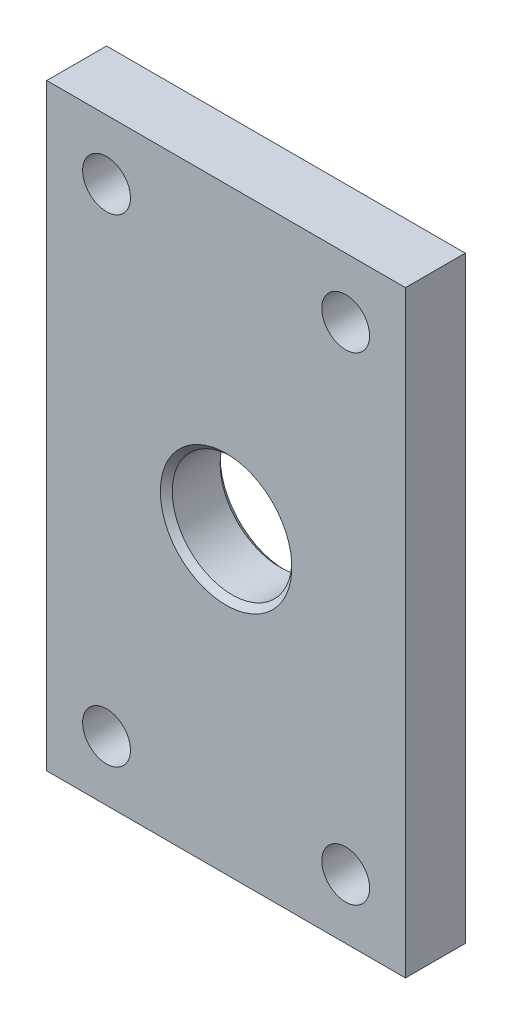
from build123d import *

# Parameters (mm, degrees)
SKETCH1_W           = 100
SKETCH1_H           = 60
BOSS_EXTRUDE1_DEPTH = 5
CUT_EXTRUDE2_START  = 5
SKETCH2_R           = 4
CUT_EXTRUDE2_DEPTH  = 64.523499554
CUT_EXTRUDE4_START  = 5
SKETCH3_R           = 4
CUT_EXTRUDE4_DEPTH  = 64.523499554
CUT_EXTRUDE6_START  = 5
SKETCH4_R           = 10
CUT_EXTRUDE6_DEPTH  = 64.523499554
CHAMFER1_SIZE       = 1


with BuildPart() as part:
    # Sketch1 → Boss-Extrude1 (new, symmetric)
    with BuildSketch(Plane(origin=(0, 0, 0), x_dir=(0, 1, 0), z_dir=(0, 0, 1))):
        Rectangle(SKETCH1_W, SKETCH1_H)
    extrude(amount=BOSS_EXTRUDE1_DEPTH, both=True)

    # Sketch2 → Cut-Extrude2 (cut, through all)
    with BuildSketch(Plane(origin=(0, 0, 0), x_dir=(0, 1, 0), z_dir=(0, 0, 1)).offset(CUT_EXTRUDE2_START)):
        with Locations(Location((-40, -20, 0), (0, 0, 270))):
            Circle(SKETCH2_R)
    extrude(amount=-CUT_EXTRUDE2_DEPTH, mode=Mode.SUBTRACT)

    # Sketch3 → Cut-Extrude4 (cut, through all)
    with BuildSketch(Plane(origin=(0, 0, 0), x_dir=(0, 1, 0), z_dir=(0, 0, 1)).offset(CUT_EXTRUDE4_START)):
        with Locations(Location((40, -20, 0), (0, 0, 270))):
            Circle(SKETCH3_R)
        with Locations(Location((-40, 20, 0), (0, 0, 270))):
            Circle(SKETCH3_R)
        with Locations(Location((40, 20, 0), (0, 0, 270))):
            Circle(SKETCH3_R)
    extrude(amount=-CUT_EXTRUDE4_DEPTH, mode=Mode.SUBTRACT)

    # Sketch4 → Cut-Extrude6 (cut, through all)
    with BuildSketch(Plane(origin=(0, 0, 0), x_dir=(0, 1, 0), z_dir=(0, 0, 1)).offset(CUT_EXTRUDE6_START)):
        with Locations(Location((0, 0, 0), (0, 0, 270))):
            Circle(SKETCH4_R)
    extrude(amount=-CUT_EXTRUDE6_DEPTH, mode=Mode.SUBTRACT)

    # Chamfer1
    chamfer1_edges = [part.edges().sort_by_distance(p)[0] for p in [
        (-10, 0, -5),
        (-10, 0, 5),
    ]]
    chamfer(chamfer1_edges, length=CHAMFER1_SIZE)


solid = part.part
